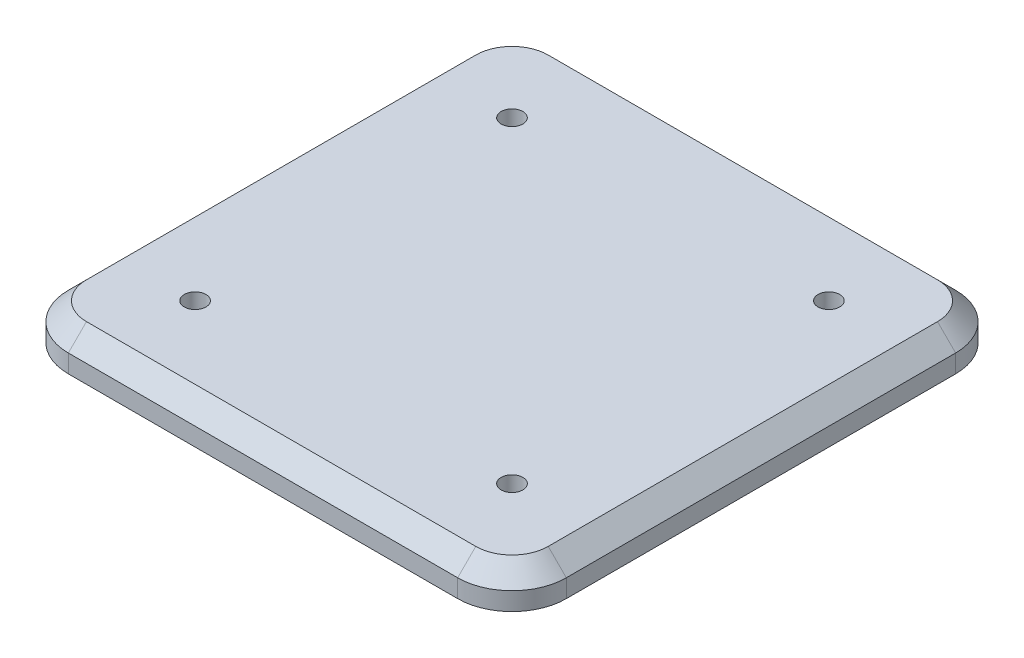
from build123d import *

# Parameters (mm, degrees)
BOSS_EXTRUDE1_DEPTH = 10
CHAMFER1_SIZE       = 10
SKETCH2_R           = 6
CUT_EXTRUDE1_DEPTH  = 10
SKETCH3_R           = 6
CUT_EXTRUDE2_DEPTH  = 10


with BuildPart() as part:
    # Sketch1 → Boss-Extrude1 (new, symmetric)
    with BuildSketch(Plane(origin=(0, 0, 0), x_dir=(1, 0, 0), z_dir=(0, 1, 0))):
        with BuildLine():
            Line((-107.5, 137.5), (107.5, 137.5))
            ThreePointArc((107.5, 137.5), (128.713203436, 128.713203436), (137.5, 107.5))
            Line((137.5, 107.5), (137.5, -107.5))
            ThreePointArc((137.5, -107.5), (128.713203436, -128.713203436), (107.5, -137.5))
            Line((107.5, -137.5), (-107.5, -137.5))
            ThreePointArc((-107.5, -137.5), (-128.713203436, -128.713203436), (-137.5, -107.5))
            Line((-137.5, -107.5), (-137.5, 107.5))
            ThreePointArc((-137.5, 107.5), (-128.713203436, 128.713203436), (-107.5, 137.5))
        make_face()
    extrude(amount=BOSS_EXTRUDE1_DEPTH, both=True)

    # Chamfer1
    chamfer1_edges = [part.edges().sort_by_distance(p)[0] for p in [
        (128.713203436, 10, 128.713203436),
        (137.5, 10, 0),
        (128.713203436, 10, -128.713203436),
        (0, 10, -137.5),
        (-128.713203436, 10, -128.713203436),
        (-137.5, 10, 0),
        (-128.713203436, 10, 128.713203436),
        (0, 10, 137.5),
    ]]
    chamfer(chamfer1_edges, length=CHAMFER1_SIZE)

    # Sketch2 → Cut-Extrude1 (cut)
    with BuildSketch(Plane(origin=(0, 10, 0), x_dir=(1, 0, 0), z_dir=(0, 1, 0))):
        with Locations(Location((87.5, 87.5, 0), (0, 0, 270))):
            Circle(SKETCH2_R)
        with Locations(Location((-87.5, 87.5, 0), (0, 0, 90))):
            Circle(SKETCH2_R)
        with Locations(Location((87.5, -87.5, 0), (0, 0, 90))):
            Circle(SKETCH2_R)
        with Locations(Location((-87.5, -87.5, 0), (0, 0, 270))):
            Circle(SKETCH2_R)
    extrude(amount=-CUT_EXTRUDE1_DEPTH, mode=Mode.SUBTRACT)

    # Sketch3 → Cut-Extrude2 (cut)
    with BuildSketch(Plane.XZ.offset(10)):
        with Locations(Location((112.5, 112.5, 0), (0, 0, 270))):
            Circle(SKETCH3_R)
        with Locations(Location((-112.5, 112.5, 0), (0, 0, 270))):
            Circle(SKETCH3_R)
        with Locations(Location((112.5, -112.5, 0), (0, 0, 270))):
            Circle(SKETCH3_R)
        with Locations(Location((-112.5, -112.5, 0), (0, 0, 270))):
            Circle(SKETCH3_R)
    extrude(amount=-CUT_EXTRUDE2_DEPTH, mode=Mode.SUBTRACT)


solid = part.part
